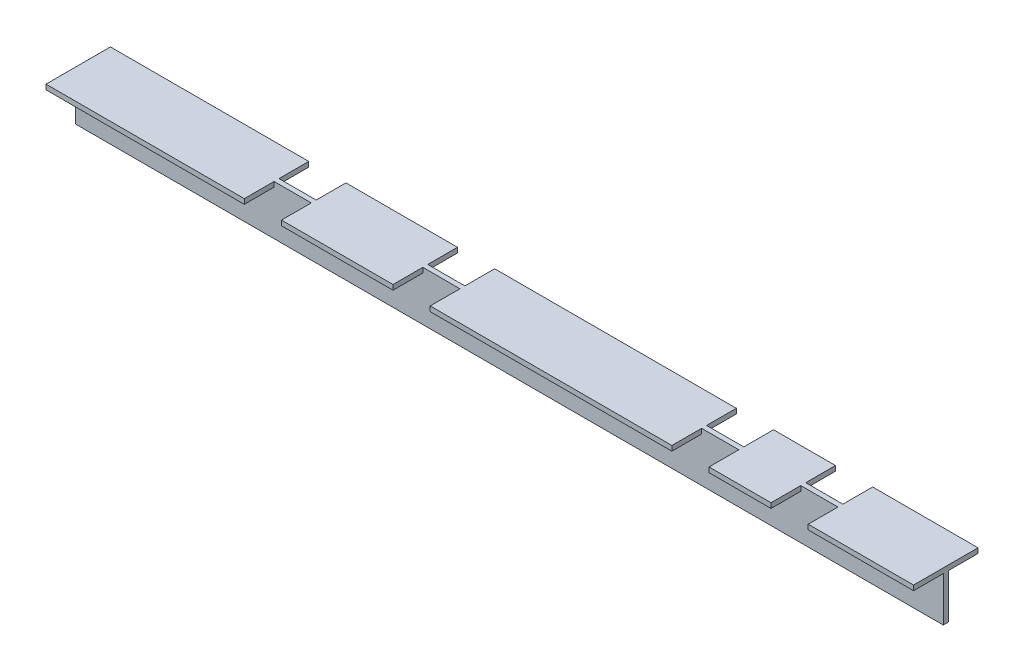
from build123d import *

# Parameters (mm, degrees)
BOSS_EXTRUDE1_DEPTH = 1400
SKETCH1_W           = 60
SKETCH1_H           = 48
CUT_EXTRUDE1_DEPTH  = 1406.702671264


with BuildPart() as part:
    # Sketch T → Boss-Extrude1 (new body)
    with BuildSketch(Plane(origin=(0, 0, 0), x_dir=(0, 0, -1), z_dir=(1, 0, 0))):
        Polygon((0, 0), (104, 0), (104, -8), (56, -8), (56, -80), (48, -80), (48, -8), (0, -8), align=None)
    extrude(amount=BOSS_EXTRUDE1_DEPTH)

    # Sketch1 → Cut-Extrude1 (cut, through all)
    with BuildSketch(Plane(origin=(0, -8, 0), x_dir=(-1, 0, 0), z_dir=(0, -1, 0))):
        with Locations((-350, 24)):
            Rectangle(SKETCH1_W, SKETCH1_H)
        with Locations((-590, 24)):
            Rectangle(SKETCH1_W, SKETCH1_H)
        with Locations((-1200, 24)):
            Rectangle(SKETCH1_W, SKETCH1_H)
        with Locations((-1200, 80)):
            Rectangle(SKETCH1_W, SKETCH1_H)
        with Locations((-590, 80)):
            Rectangle(SKETCH1_W, SKETCH1_H)
        with Locations((-350, 80)):
            Rectangle(SKETCH1_W, SKETCH1_H)
        with Locations((-1040, 24)):
            Rectangle(SKETCH1_W, SKETCH1_H)
        with Locations((-1040, 80)):
            Rectangle(SKETCH1_W, SKETCH1_H)
    extrude(amount=-CUT_EXTRUDE1_DEPTH, mode=Mode.SUBTRACT)


solid = part.part
